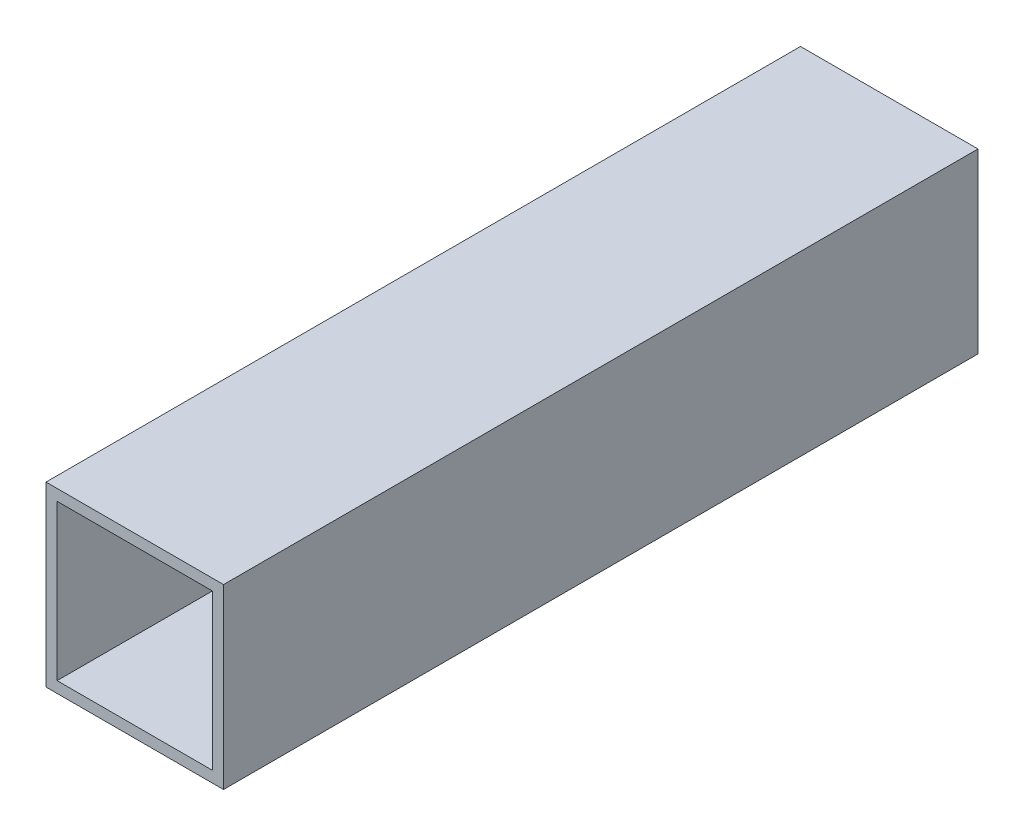
from build123d import *

# Parameters (mm, degrees)
SKETCH1_W           = 50.8
SKETCH1_H           = 50.8
SKETCH1_W_2         = 44.45
SKETCH1_H_2         = 44.45
BOSS_EXTRUDE1_DEPTH = 215.9


with BuildPart() as part:
    # Sketch1 → Boss-Extrude1 (new body)
    with BuildSketch(Plane.XY):
        Rectangle(SKETCH1_W, SKETCH1_H)
        Rectangle(SKETCH1_W_2, SKETCH1_H_2, mode=Mode.SUBTRACT)
    extrude(amount=BOSS_EXTRUDE1_DEPTH)


solid = part.part
